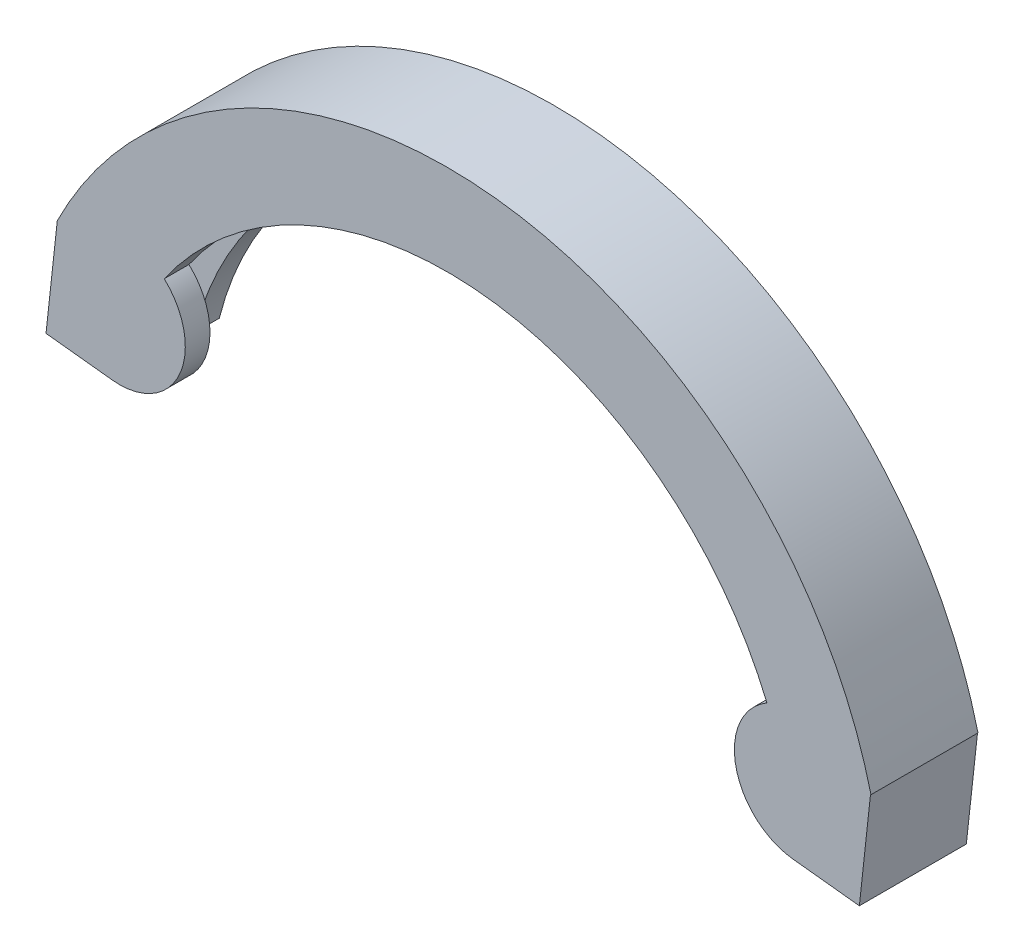
from build123d import *

# Parameters (mm, degrees)
SKETCH1_W                    = 50
SKETCH1_H                    = 7
REVOLVE5_ANGLE               = 167.5
SHELL2_T                     = 3
CUT_EXTRUDE3_DEPTH           = 77.072333999
CUT_EXTRUDE3_DEPTH_BACK      = 10
CUT_EXTRUDE4_DEPTH           = 77.072333999
CUT_EXTRUDE4_DEPTH_BACK      = 10
CUT_EXTRUDE_THIN1_DEPTH      = 77.072333999
CUT_EXTRUDE_THIN1_DEPTH_BACK = 20
CUT_EXTRUDE_THIN2_DEPTH      = 77.072333999
CUT_EXTRUDE_THIN2_DEPTH_BACK = 20
CUT_EXTRUDE_THIN3_DEPTH      = 76.000787866
CUT_EXTRUDE_THIN3_DEPTH_BACK = 20
SKETCH18_R                   = 8
BOSS_EXTRUDE3_DEPTH          = 3


with BuildPart() as part:
    # Sketch1 → Revolve5 (revolve)
    with BuildSketch(Plane(origin=(0, 0, 0), x_dir=(1, 0, 0), z_dir=(0, 1, 0))):
        with Locations((25, 3.5)):
            Rectangle(SKETCH1_W, SKETCH1_H)
    revolve(axis=Axis((0, 0, 0), (0, 0, 1)), revolution_arc=REVOLVE5_ANGLE)

    # Shell2
    shell2_openings = [part.faces().sort_by_distance(p)[0] for p in [
        (25, 0, -3.5),
        (-24.407400178, 5.410990348, -3.5),
    ]]
    offset(amount=SHELL2_T, openings=shell2_openings, kind=Kind.INTERSECTION)

    # Sketch11 → Cut-Extrude3 (cut, two sides: drawn at the far end of the back side and taken through both)
    with BuildSketch(Plane.XY.offset(3).offset(-CUT_EXTRUDE3_DEPTH_BACK)):
        Polygon((-295.067343662, 38.119573796), (-51.743688377, 11.471299539), (53, 0), (296.323655284, -26.648274258), (243.027106769, -513.295584826), (-348.363892177, -448.527736772), align=None)
    extrude(amount=CUT_EXTRUDE3_DEPTH + CUT_EXTRUDE3_DEPTH_BACK, mode=Mode.SUBTRACT)

    # Sketch12 → Cut-Extrude4 (cut, two sides: drawn at the far end of the back side and taken through both)
    with BuildSketch(Plane(origin=(0, 0, -10), x_dir=(-1, 0, 0), z_dir=(0, 0, -1)).offset(-CUT_EXTRUDE4_DEPTH_BACK)):
        Polygon((-296.323655284, -26.648274258), (-53, 0), (51.743688377, 11.471299539), (295.067343662, 38.119573796), (348.363892177, -448.527736772), (-243.027106769, -513.295584826), align=None)
    extrude(amount=CUT_EXTRUDE4_DEPTH + CUT_EXTRUDE4_DEPTH_BACK, mode=Mode.SUBTRACT)

    # Sketch13 → Cut-Extrude-Thin1 (cut, two sides: drawn at the far end of the back side and taken through both)
    with BuildSketch(Plane(origin=(0, 0, -10), x_dir=(-1, 0, 0), z_dir=(0, 0, -1)).offset(-CUT_EXTRUDE_THIN1_DEPTH_BACK)):
        Polygon((48.779244367, 11.146640118), (47.419699991, 23.560551191), (57.360263374, 24.64921994), (58.719807749, 12.235308866), align=None)
    extrude(amount=CUT_EXTRUDE_THIN1_DEPTH + CUT_EXTRUDE_THIN1_DEPTH_BACK, mode=Mode.SUBTRACT)

    # Sketch14 → Cut-Extrude-Thin2 (cut, two sides: drawn at the far end of the back side and taken through both)
    with BuildSketch(Plane(origin=(0, 0, -10), x_dir=(-1, 0, 0), z_dir=(0, 0, -1)).offset(-CUT_EXTRUDE_THIN2_DEPTH_BACK)):
        Polygon((-50.035555989, 0.324659421), (-51.39409796, 12.729417605), (-81.215788107, 9.46341136), (-79.857246136, -2.941346825), align=None)
    extrude(amount=CUT_EXTRUDE_THIN2_DEPTH + CUT_EXTRUDE_THIN2_DEPTH_BACK, mode=Mode.SUBTRACT)

    # Sketch15 → Cut-Extrude-Thin3 (cut, two sides: drawn at the far end of the back side and taken through both)
    with BuildSketch(Plane(origin=(0, 0, -10), x_dir=(-1, 0, 0), z_dir=(0, 0, -1)).offset(-CUT_EXTRUDE_THIN3_DEPTH_BACK)):
        with BuildLine():
            ThreePointArc((-41.982664634, 1.20659446), (-4.572408744, 41.750366205), (40.726353012, 10.264705079))
            Line((40.726353012, 10.264705079), (11.636100861, 2.93277288))
            ThreePointArc((11.636100861, 2.93277288), (-1.306402498, 11.928676059), (-11.995047038, 0.344741274))
            Line((-11.995047038, 0.344741274), (-41.982664634, 1.20659446))
        make_face()
    extrude(amount=CUT_EXTRUDE_THIN3_DEPTH + CUT_EXTRUDE_THIN3_DEPTH_BACK, mode=Mode.SUBTRACT)


with BuildPart() as body_2:
    # of the pieces the cut leaves, the one that is kept (cut_extrude_thin3_keep)
    add(part.part.solids().sort_by_distance((49.998919737, 0.328671743, 0))[0])

    # Sketch18 → Boss-Extrude3 (add)
    with BuildSketch(Plane.XY.offset(3)):
        with Locations((-39.855418013, 18.217155785)):
            Circle(SKETCH18_R)
        with Locations((42.853599633, 9.159045166)):
            Circle(SKETCH18_R)
    extrude(amount=-BOSS_EXTRUDE3_DEPTH)


solid = body_2.part
